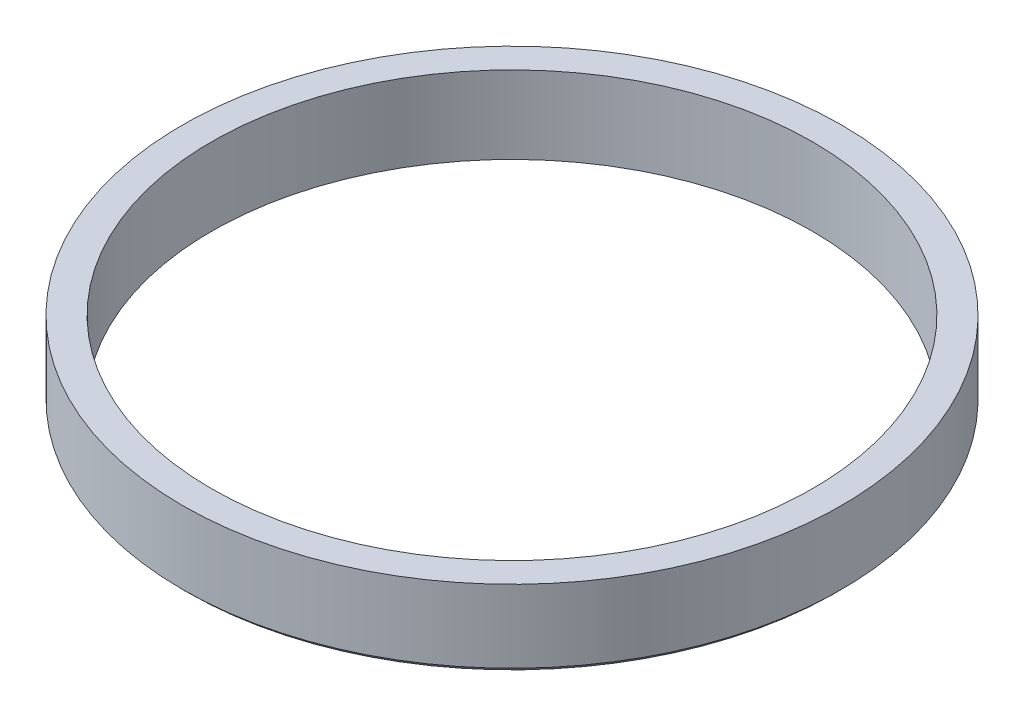
from build123d import *

# Parameters (mm, degrees)
SCHIZZO1_W   = 6
SCHIZZO1_H   = 16
SMUSSO1_SIZE = 1


with BuildPart() as part:
    # Schizzo1 → Rivoluzione1 (revolve)
    with BuildSketch(Plane.XY, mode=Mode.PRIVATE) as rivoluzione1_sk:
        with Locations((-65, 8)):
            Rectangle(SCHIZZO1_W, SCHIZZO1_H)
    revolve(rivoluzione1_sk.sketch.rotate(Axis((0, 0, 0), (0, 1, 0)), 270), axis=Axis((0, 0, 0), (0, 1, 0)))

    # Smusso1
    smusso1_edges = [part.edges().sort_by_distance(p)[0] for p in [
        (0, 0, 68),
    ]]
    chamfer(smusso1_edges, length=SMUSSO1_SIZE)


solid = part.part
